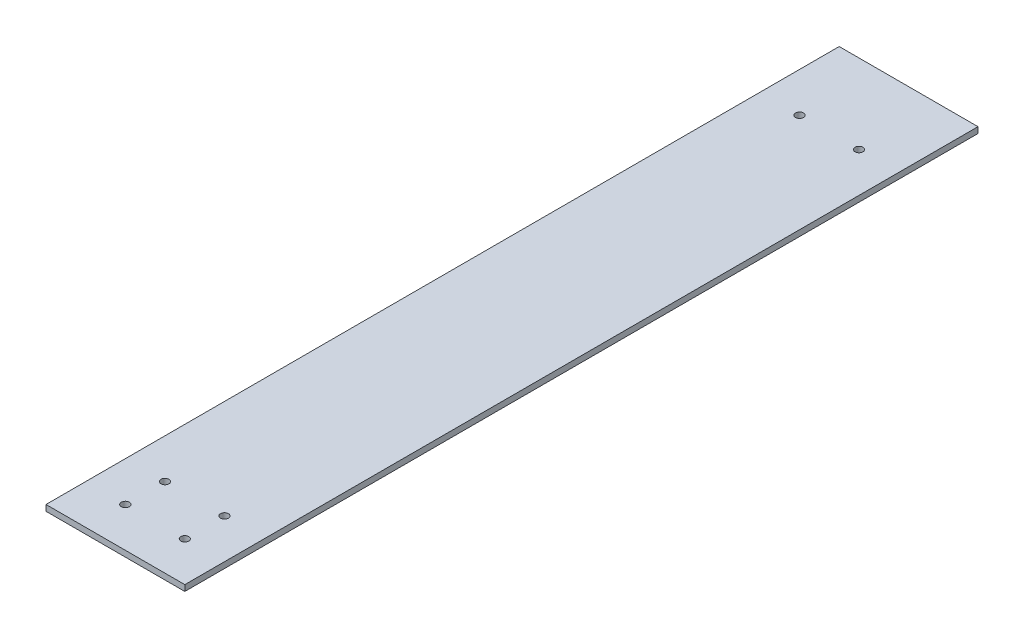
from build123d import *

# Parameters (mm, degrees)
CROQUIS2_W              = 70
CROQUIS2_H              = 400
SALIENTE_EXTRUIR1_DEPTH = 3
CROQUIS3_R              = 2
CORTAR_EXTRUIR1_DEPTH   = 377.219174253


with BuildPart() as part:
    # Croquis2 → Saliente-Extruir1 (new body)
    with BuildSketch(Plane(origin=(0, 0, 0), x_dir=(1, 0, 0), z_dir=(0, 1, 0))):
        with Locations((-64.039233631, 162.936767602)):
            Rectangle(CROQUIS2_W, CROQUIS2_H)
    extrude(amount=SALIENTE_EXTRUIR1_DEPTH)

    # Croquis3 → Cortar-Extruir1 (cut, through all)
    with BuildSketch(Plane(origin=(0, 3, 0), x_dir=(1, 0, 0), z_dir=(0, 1, 0))):
        with Locations(Location((-79.039233631, 322.936767602, 0), (0, 0, 270))):
            Circle(CROQUIS3_R)
        with Locations(Location((-49.039233631, 322.936767602, 0), (0, 0, 270))):
            Circle(CROQUIS3_R)
        with Locations(Location((-79.039233631, 2.936767602, 0), (0, 0, 270))):
            Circle(CROQUIS3_R)
        with Locations(Location((-49.039233631, 2.936767602, 0), (0, 0, 270))):
            Circle(CROQUIS3_R)
        with Locations(Location((-79.039233631, -17.063232398, 0), (0, 0, 270))):
            Circle(CROQUIS3_R)
        with Locations(Location((-49.039233631, -17.063232398, 0), (0, 0, 270))):
            Circle(CROQUIS3_R)
    extrude(amount=-CORTAR_EXTRUIR1_DEPTH, mode=Mode.SUBTRACT)


solid = part.part
